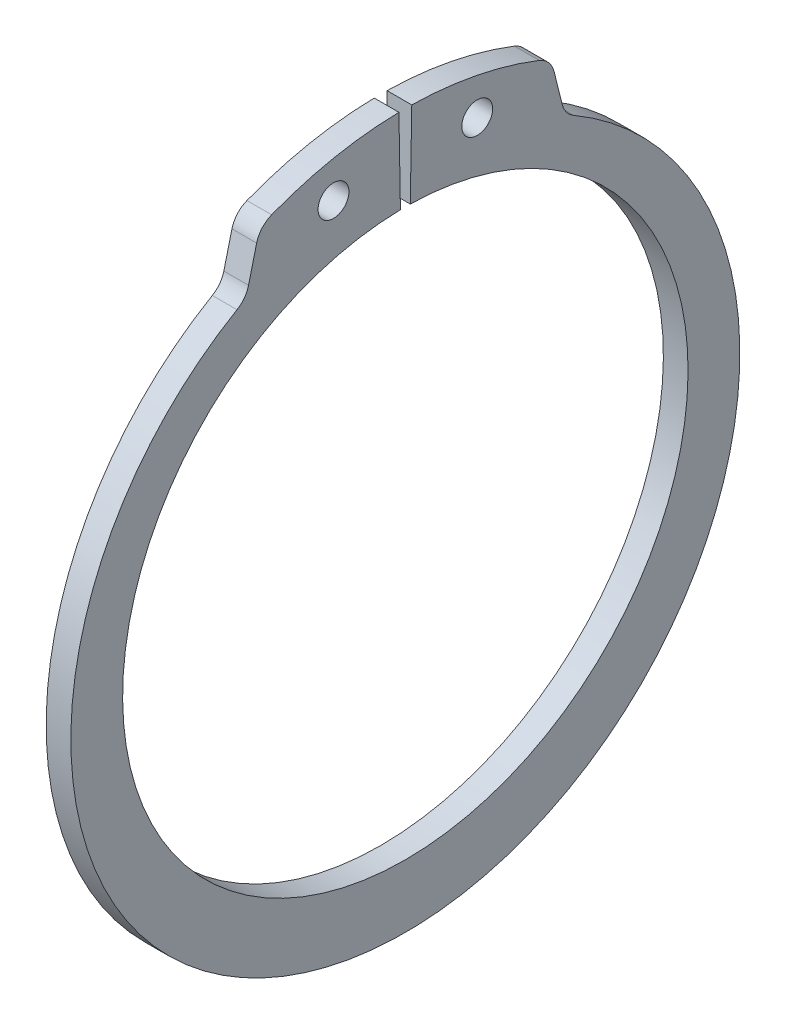
from build123d import *

# Parameters (mm, degrees)
SKETCH1_R      = 1.25
EXTRUDE1_DEPTH = 1
FILLET1_R      = 2


with BuildPart() as part:
    # Sketch1 → Extrude1 (new, symmetric)
    with BuildSketch(Plane(origin=(0, 0, 0), x_dir=(0, 0, -1), z_dir=(1, 0, 0))):
        with BuildLine():
            Line((-0.399660107, 22.896512219), (-0.520081712, 29.795461316))
            ThreePointArc((-0.520081712, 29.795461316), (-6.279068206, 29.1309681), (-11.800426172, 27.364026425))
            Line((-11.800426172, 27.364026425), (-12.910119658, 22.913288948))
            ThreePointArc((-12.910119658, 22.913288948), (0, -28), (12.910119658, 22.913288948))
            Line((12.910119658, 22.913288948), (11.800426172, 27.364026425))
            ThreePointArc((11.800426172, 27.364026425), (6.279068206, 29.1309681), (0.520081712, 29.795461316))
            Line((0.520081712, 29.795461316), (0.399660107, 22.896512219))
            ThreePointArc((0.399660107, 22.896512219), (0, -22.9), (-0.399660107, 22.896512219))
        make_face()
        with Locations((-5.820259343, 26.252420839)):
            Circle(SKETCH1_R, mode=Mode.SUBTRACT)
        with Locations((5.820259343, 26.252420839)):
            Circle(SKETCH1_R, mode=Mode.SUBTRACT)
    extrude(amount=EXTRUDE1_DEPTH, both=True)

    # Fillet1
    fillet1_edges = [part.edges().sort_by_distance(p)[0] for p in [
        (0, 27.364026425, -11.800426172),
        (0, 22.913288948, -12.910119658),
        (0, 22.913288948, 12.910119658),
        (0, 27.364026425, 11.800426172),
    ]]
    fillet(fillet1_edges, radius=FILLET1_R)


solid = part.part
